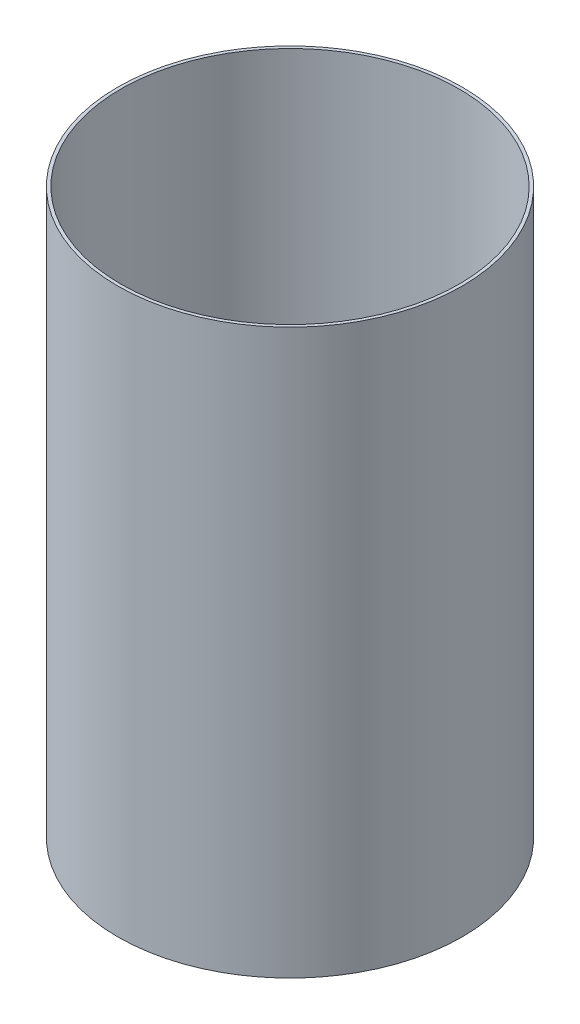
from build123d import *

# Parameters (mm, degrees)
SKETCH1_R           = 77.6224
SKETCH1_R_2         = 76.2
BOSS_EXTRUDE1_DEPTH = 254


with BuildPart() as part:
    # Sketch1 → Boss-Extrude1 (new body)
    with BuildSketch(Plane(origin=(0, 0, 0), x_dir=(1, 0, 0), z_dir=(0, 1, 0))):
        with Locations(Location((0, 0, 0), (0, 0, 270))):
            Circle(SKETCH1_R)
        with Locations(Location((0, 0, 0), (0, 0, 270))):
            Circle(SKETCH1_R_2, mode=Mode.SUBTRACT)
    extrude(amount=BOSS_EXTRUDE1_DEPTH)


solid = part.part
